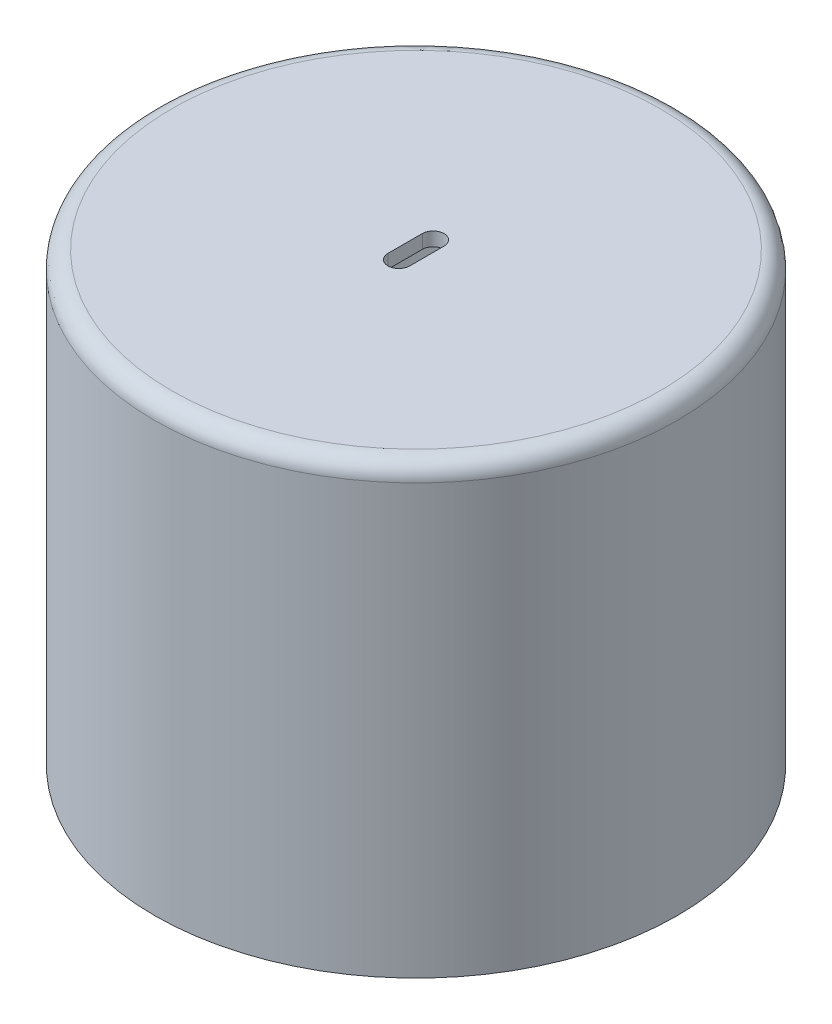
from build123d import *

# Parameters (mm, degrees)
SKETCH1_R           = 76.2
BOSS_EXTRUDE1_DEPTH = 130
SKETCH1_3_R         = 72.2
CUT_EXTRUDE1_DEPTH  = 126
FILLET1_R           = 5


with BuildPart() as part:
    # Sketch1 → Boss-Extrude1 (new body)
    with BuildSketch(Plane(origin=(0, 0, 0), x_dir=(1, 0, 0), z_dir=(0, 1, 0))):
        with Locations(Location((0, 0, 0), (0, 0, 270))):
            Circle(SKETCH1_R)
        with BuildLine():
            Line((-3.175, -5), (-3.175, 5))
            ThreePointArc((-3.175, 5), (0, 8.175), (3.175, 5))
            Line((3.175, 5), (3.175, -5))
            ThreePointArc((3.175, -5), (0, -8.175), (-3.175, -5))
        make_face(mode=Mode.SUBTRACT)
    extrude(amount=BOSS_EXTRUDE1_DEPTH)

    # Sketch1<3> → Cut-Extrude1 (cut)
    with BuildSketch(Plane(origin=(0, 0, 0), x_dir=(1, 0, 0), z_dir=(0, 1, 0))):
        with Locations(Location((0, 0, 0), (0, 0, 270))):
            Circle(SKETCH1_3_R)
    extrude(amount=CUT_EXTRUDE1_DEPTH, mode=Mode.SUBTRACT)

    # Fillet1
    fillet1_edges = [part.edges().sort_by_distance(p)[0] for p in [
        (0, 130, -76.2),
    ]]
    fillet(fillet1_edges, radius=FILLET1_R)


solid = part.part
